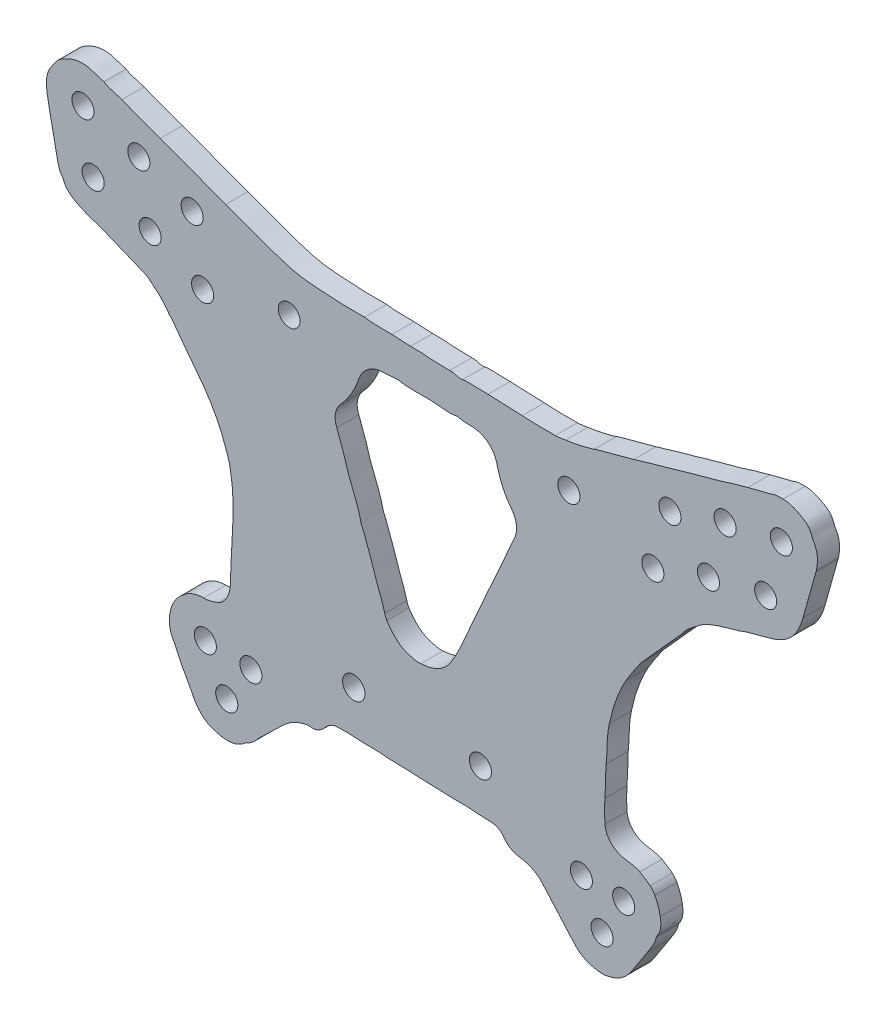
from build123d import *

# Parameters (mm, degrees)
MODEL_R             = 1.5
MODEL_R_2           = 1.523687082
MODEL_R_3           = 1.475714076
BOSS_EXTRUDE1_DEPTH = 3


with BuildPart() as part:
    # Model → Boss-Extrude1 (new body)
    with BuildSketch(Plane.XY):
        with BuildLine():
            add(Edge.make_bspline(
                [(106.400319922, 210.053194787), (105.745680217, 209.783149141), (105.084097363, 209.566078117), (104.35840404, 209.57292321)],
                knots=[138, 138, 138, 138, 139, 139, 139, 139], degree=3))
            add(Edge.make_bspline(
                [(104.35840404, 209.57292321), (103.396302713, 209.581977731), (102.505616627, 209.272823165), (101.756717483, 208.698599326), (100.458069769, 207.702849885), (99.720732207, 206.382562486), (99.728791219, 204.7593255)],
                knots=[139, 139, 139, 139, 140, 140, 140, 141, 141, 141, 141], degree=3))
            add(Edge.make_bspline(
                [(99.728791219, 204.7593255), (99.705781708, 203.731147042), (99.827379793, 203.274002176), (100.308316804, 202.456596844)],
                knots=[0, 0, 0, 0, 1, 1, 1, 1], degree=3))
            add(Edge.make_bspline(
                [(100.308316804, 202.456596844), (100.407421981, 202.288143534), (100.479539802, 202.103790611), (100.563312194, 201.926386026), (100.83953998, 201.34143511), (101.09793462, 200.747264482), (101.396097382, 200.173722055)],
                knots=[1, 1, 1, 1, 2, 2, 2, 3, 3, 3, 3], degree=3))
            add(Edge.make_bspline(
                [(101.396097382, 200.173722055), (101.720813554, 199.549063403), (102.089575323, 198.947407568), (102.425336474, 198.328262158)],
                knots=[3, 3, 3, 3, 4, 4, 4, 4], degree=3))
            add(Edge.make_bspline(
                [(102.425336474, 198.328262158), (102.666848518, 197.88289746), (102.862062574, 197.411288076), (103.119372347, 196.97584515), (103.772141948, 195.871173031), (104.633216333, 195.015061431), (105.946463256, 194.732936209)],
                knots=[4, 4, 4, 4, 5, 5, 5, 6, 6, 6, 6], degree=3))
            add(Edge.make_bspline(
                [(105.946463256, 194.732936209), (106.083363132, 194.703511599), (106.21172872, 194.636413164), (106.347523064, 194.599565293)],
                knots=[6, 6, 6, 6, 7, 7, 7, 7], degree=3))
            add(Edge.make_bspline(
                [(106.347523064, 194.599565293), (107.646987012, 194.24687263), (108.852604803, 194.390908675), (109.917065908, 195.278055495)],
                knots=[7, 7, 7, 7, 8, 8, 8, 8], degree=3))
            add(Edge.make_bspline(
                [(109.917065908, 195.278055495), (110.003183679, 195.34982057), (110.090221003, 195.433231595), (110.191826541, 195.471679751)],
                knots=[8, 8, 8, 8, 9, 9, 9, 9], degree=3))
            add(Edge.make_bspline(
                [(110.191826541, 195.471679751), (110.938070344, 195.754032111), (111.427675958, 196.33553467), (111.922850555, 196.917398583)],
                knots=[9, 9, 9, 9, 10, 10, 10, 10], degree=3))
            add(Edge.make_bspline(
                [(111.922850555, 196.917398583), (112.10405433, 197.130308864), (112.318062414, 197.316107207), (112.523319238, 197.507635605), (112.914377606, 197.872542062), (113.316181323, 198.226143275), (113.701929009, 198.596470056), (114.148801198, 199.025480865), (114.576548732, 199.474407489), (115.024423132, 199.902313585)],
                knots=[10, 10, 10, 10, 11, 11, 11, 12, 12, 12, 13, 13, 13, 13], degree=3))
            add(Edge.make_bspline(
                [(115.024423132, 199.902313585), (115.828815802, 200.670822444), (116.714852459, 201.293158101), (117.831872784, 201.545311519), (118.162870852, 201.620029379), (118.474010689, 201.740732225), (118.82142641, 201.67948774)],
                knots=[13, 13, 13, 13, 14, 14, 14, 15, 15, 15, 15], degree=3))
            add(Edge.make_bspline(
                [(118.82142641, 201.67948774), (119.526021654, 201.555295238), (120.089429216, 201.84693958), (120.585564696, 202.306407441)],
                knots=[15, 15, 15, 15, 16, 16, 16, 16], degree=3))
            add(Edge.make_bspline(
                [(120.585564696, 202.306407441), (120.750278493, 202.458940488), (120.884244061, 202.644067743), (121.041911389, 202.804829356)],
                knots=[16, 16, 16, 16, 17, 17, 17, 17], degree=3))
            add(Edge.make_bspline(
                [(121.041911389, 202.804829356), (121.431822898, 203.202422942), (121.907180593, 203.453141265), (122.462177853, 203.476360896), (123.165719227, 203.50579583), (123.875821463, 203.533186528), (124.575240342, 203.471921393), (125.701022259, 203.373312815), (126.8260706, 203.373921956), (127.952834063, 203.367871843), (128.233081023, 203.366364478), (128.513441635, 203.337404467), (128.793254648, 203.314907546)],
                knots=[17, 17, 17, 17, 18, 18, 18, 19, 19, 19, 20, 20, 20, 21, 21, 21, 21], degree=3))
            add(Edge.make_bspline(
                [(128.793254648, 203.314907546), (129.017780775, 203.296860452), (129.241170375, 203.25482972), (129.465748163, 203.248717661)],
                knots=[21, 21, 21, 21, 22, 22, 22, 22], degree=3))
            add(Edge.make_bspline(
                [(129.465748163, 203.248717661), (130.732366472, 203.214275381), (131.998571499, 203.220562955), (133.265024496, 203.119497164)],
                knots=[22, 22, 22, 22, 23, 23, 23, 23], degree=3))
            add(Edge.make_bspline(
                [(133.265024496, 203.119497164), (134.66724084, 203.007601052), (136.07843575, 203.071116911), (137.484547283, 202.960810761)],
                knots=[23, 23, 23, 23, 24, 24, 24, 24], degree=3))
            add(Edge.make_bspline(
                [(137.484547283, 202.960810761), (138.352688801, 202.892721181), (139.229891541, 202.942361014), (140.102951122, 202.932645731)],
                knots=[24, 24, 24, 24, 25, 25, 25, 25], degree=3))
            add(Edge.make_bspline(
                [(140.102951122, 202.932645731), (140.27121915, 202.930766685), (140.438774265, 202.893619406), (140.607290263, 202.881591452)],
                knots=[25, 25, 25, 25, 26, 26, 26, 26], degree=3))
            add(Edge.make_bspline(
                [(140.607290263, 202.881591452), (141.028642248, 202.85148543), (141.450128551, 202.822071145), (141.871986808, 202.800534395)],
                knots=[26, 26, 26, 26, 27, 27, 27, 27], degree=3))
            add(Edge.make_bspline(
                [(141.871986808, 202.800534395), (142.350764417, 202.776106807), (142.82986232, 202.749779525), (143.309073875, 202.743574546)],
                knots=[27, 27, 27, 27, 28, 28, 28, 28], degree=3))
            add(Edge.make_bspline(
                [(143.309073875, 202.743574546), (144.107897562, 202.733219148), (144.72139498, 202.385234422), (145.15806942, 201.733216044)],
                knots=[28, 28, 28, 28, 29, 29, 29, 29], degree=3))
            add(Edge.make_bspline(
                [(145.15806942, 201.733216044), (145.436497936, 201.317503094), (145.824074397, 201.062272997), (146.255696457, 200.835589934)],
                knots=[29, 29, 29, 29, 30, 30, 30, 30], degree=3))
            add(Edge.make_bspline(
                [(146.255696457, 200.835589934), (146.642652995, 200.632374287), (147.05740279, 200.584035332), (147.473330441, 200.5088219), (148.581723491, 200.308393848), (149.575812894, 199.885278285), (150.339393904, 199.015765582)],
                knots=[30, 30, 30, 30, 31, 31, 31, 32, 32, 32, 32], degree=3))
            add(Edge.make_bspline(
                [(150.339393904, 199.015765582), (151.548431609, 197.639013906), (152.768183667, 196.271636807), (153.973284855, 194.89147807), (154.474328066, 194.317646559), (154.959067277, 193.734233982), (155.590852452, 193.29011854), (156.389996433, 192.728356281), (158.0265647, 192.330174203), (158.974387111, 192.490058241)],
                knots=[32, 32, 32, 32, 33, 33, 33, 34, 34, 34, 35, 35, 35, 35], degree=3))
            add(Edge.make_bspline(
                [(158.974387111, 192.490058241), (160.409366437, 192.732124696), (161.557723919, 193.431139854), (162.380187373, 194.63819929)],
                knots=[35, 35, 35, 35, 36, 36, 36, 36], degree=3))
            add(Edge.make_bspline(
                [(162.380187373, 194.63819929), (162.745053953, 195.173675564), (163.091787758, 195.721551472), (163.443449958, 196.2659274), (163.810362288, 196.833915287), (164.173493081, 197.404339738), (164.537905051, 197.973948559)],
                knots=[36, 36, 36, 36, 37, 37, 37, 38, 38, 38, 38], degree=3))
            add(Edge.make_bspline(
                [(164.537905051, 197.973948559), (165.023460495, 198.732866028), (165.563155965, 199.46309192), (165.78411753, 200.361017439)],
                knots=[38, 38, 38, 38, 39, 39, 39, 39], degree=3))
            add(Edge.make_bspline(
                [(165.78411753, 200.361017439), (165.810505626, 200.468226263), (165.862961526, 200.575796441), (165.927619595, 200.6657738)],
                knots=[39, 39, 39, 39, 40, 40, 40, 40], degree=3))
            add(Edge.make_bspline(
                [(165.927619595, 200.6657738), (166.464349763, 201.412766558), (166.466033889, 202.253866445), (166.327119261, 203.101966292)],
                knots=[40, 40, 40, 40, 41, 41, 41, 41], degree=3))
            add(Edge.make_bspline(
                [(166.327119261, 203.101966292), (166.203630408, 203.855835116), (165.955278536, 204.581476965), (165.594038511, 205.255032091)],
                knots=[41, 41, 41, 41, 42, 42, 42, 42], degree=3))
            add(Edge.make_bspline(
                [(165.594038511, 205.255032091), (165.437931325, 205.546118914), (165.222001476, 205.832797208), (164.965580261, 206.03637421)],
                knots=[42, 42, 42, 42, 43, 43, 43, 43], degree=3))
            add(Edge.make_bspline(
                [(164.965580261, 206.03637421), (164.525992179, 206.385360405), (164.048299437, 206.69453562), (163.557102685, 206.967389509)],
                knots=[43, 43, 43, 43, 44, 44, 44, 44], degree=3))
            add(Edge.make_bspline(
                [(163.557102685, 206.967389509), (163.267722179, 207.128140798), (162.926753667, 207.209125583), (162.599547467, 207.285619244), (162.189095811, 207.381574445), (161.768229432, 207.432318991), (161.353107682, 207.5092979), (160.001394477, 207.759954276), (158.933720099, 208.836038064), (158.822009801, 210.197943218)],
                knots=[44, 44, 44, 44, 45, 45, 45, 46, 46, 46, 47, 47, 47, 47], degree=3))
            add(Edge.make_bspline(
                [(158.822009801, 210.197943218), (158.739353273, 211.205539936), (158.738196081, 212.228803967), (158.81049988, 213.237221477)],
                knots=[47, 47, 47, 47, 48, 48, 48, 48], degree=3))
            add(Edge.make_bspline(
                [(158.81049988, 213.237221477), (158.866943956, 214.024624032), (158.926115699, 214.806941809), (158.914977731, 215.597255852), (158.906650086, 216.187936823), (158.949342183, 216.779830915), (158.982456455, 217.37044994)],
                knots=[48, 48, 48, 48, 49, 49, 49, 50, 50, 50, 50], degree=3))
            add(Edge.make_bspline(
                [(158.982456455, 217.37044994), (159.009226838, 217.848001031), (159.093216203, 218.325041063), (159.08584944, 218.801286114), (159.067479026, 219.989286662), (159.174488235, 221.152916407), (159.417095478, 222.32307635)],
                knots=[50, 50, 50, 50, 51, 51, 51, 52, 52, 52, 52], degree=3))
            add(Edge.make_bspline(
                [(159.417095478, 222.32307635), (159.873276858, 224.523324769), (160.582542196, 226.62533629), (161.693569923, 228.573162856)],
                knots=[52, 52, 52, 52, 53, 53, 53, 53], degree=3))
            add(Edge.make_bspline(
                [(161.693569923, 228.573162856), (162.292654109, 229.623487205), (163.018357764, 230.602041316), (163.695511041, 231.60720147)],
                knots=[53, 53, 53, 53, 54, 54, 54, 54], degree=3))
            add(Edge.make_bspline(
                [(163.695511041, 231.60720147), (163.804380021, 231.76882001), (163.959030386, 231.899465277), (164.091218839, 232.045602343)],
                knots=[54, 54, 54, 54, 55, 55, 55, 55], degree=3))
            add(Edge.make_bspline(
                [(164.091218839, 232.045602343), (165.148003219, 233.213986485), (166.206327077, 234.380981992), (167.260208146, 235.551978214), (167.749782764, 236.095956651), (168.229428267, 236.648845067), (168.71583094, 237.195693695)],
                knots=[55, 55, 55, 55, 56, 56, 56, 57, 57, 57, 57], degree=3))
            add(Edge.make_bspline(
                [(168.71583094, 237.195693695), (168.903202958, 237.406363576), (169.127047169, 237.591243045), (169.282224469, 237.822716641)],
                knots=[57, 57, 57, 57, 58, 58, 58, 58], degree=3))
            add(Edge.make_bspline(
                [(169.282224469, 237.822716641), (169.811691194, 238.612571247), (170.547065663, 239.175933792), (171.301502794, 239.722601742), (171.347180858, 239.755696685), (171.394687698, 239.786829987), (171.43720415, 239.823652046), (172.289361962, 240.561667717), (173.335917596, 240.925541733), (174.374083593, 241.26874625)],
                knots=[58, 58, 58, 58, 59, 59, 59, 60, 60, 60, 61, 61, 61, 61], degree=3))
            add(Edge.make_bspline(
                [(174.374083593, 241.26874625), (175.603124179, 241.675063975), (176.880188207, 241.932281523), (178.084535154, 242.4239874)],
                knots=[61, 61, 61, 61, 62, 62, 62, 62], degree=3))
            add(Edge.make_bspline(
                [(178.084535154, 242.4239874), (178.213603323, 242.4766781), (178.357838965, 242.491338783), (178.493664306, 242.528625442), (179.552101816, 242.819170233), (180.613246328, 243.100639854), (181.666745111, 243.408142512), (182.016733517, 243.51029753), (182.356141887, 243.661519375), (182.684102327, 243.823292781), (183.295843294, 244.125049897), (183.827076802, 244.528053481), (184.28249361, 245.0494937)],
                knots=[62, 62, 62, 62, 63, 63, 63, 64, 64, 64, 65, 65, 65, 66, 66, 66, 66], degree=3))
            add(Edge.make_bspline(
                [(184.28249361, 245.0494937), (185.009395785, 245.881843638), (185.403068165, 246.868837966), (185.698048651, 247.904594552)],
                knots=[66, 66, 66, 66, 67, 67, 67, 67], degree=3))
            add(Edge.make_bspline(
                [(185.698048651, 247.904594552), (186.292225106, 249.990876812), (186.86914701, 252.082058012), (187.453239368, 254.171213043)],
                knots=[67, 67, 67, 67, 68, 68, 68, 68], degree=3))
            add(Edge.make_bspline(
                [(187.453239368, 254.171213043), (187.475990578, 254.25264436), (187.504279775, 254.332973544), (187.520769752, 254.415651535)],
                knots=[68, 68, 68, 68, 69, 69, 69, 69], degree=3))
            add(Edge.make_bspline(
                [(187.520769752, 254.415651535), (187.746918014, 255.550303201), (187.760370364, 256.654064189), (187.089777949, 257.674556113), (186.968541486, 257.859048416), (186.911074534, 258.086276093), (186.829905823, 258.295990964), (186.629298429, 258.814289977), (186.291171235, 259.226789451), (185.820442306, 259.510393647), (184.948395267, 260.035780378), (184.064549008, 260.514250342), (182.991357307, 260.51895828)],
                knots=[69, 69, 69, 69, 70, 70, 70, 71, 71, 71, 72, 72, 72, 73, 73, 73, 73], degree=3))
            add(Edge.make_bspline(
                [(182.991357307, 260.51895828), (182.47808093, 260.521206423), (181.980426637, 260.545448172), (181.499138336, 260.335082862), (181.37128935, 260.279199333), (181.23081458, 260.250435487), (181.094451973, 260.215804786), (180.138632542, 259.973054337), (179.180374744, 259.739446166), (178.226828368, 259.488108377)],
                knots=[73, 73, 73, 73, 74, 74, 74, 75, 75, 75, 76, 76, 76, 76], degree=3))
            add(Edge.make_bspline(
                [(178.226828368, 259.488108377), (177.464776504, 259.287249281), (176.689044985, 259.115977403), (175.95524099, 258.837316025), (175.347839491, 258.606658058), (174.73202769, 258.445367319), (174.106793045, 258.28466249), (172.688531002, 257.920130292), (171.282760427, 257.507065557), (169.872268097, 257.112463473), (169.763843396, 257.082130314), (169.659210563, 257.038365079), (169.55107516, 257.006823962), (169.20101443, 256.904723147), (168.850468093, 256.804274241), (168.499529137, 256.705229456), (167.495913569, 256.42197629), (166.490427897, 256.14517847), (165.488682433, 255.855503512), (164.569975784, 255.589838004), (163.65924549, 255.296061668), (162.737790511, 255.040663799)],
                knots=[76, 76, 76, 76, 77, 77, 77, 78, 78, 78, 79, 79, 79, 80, 80, 80, 81, 81, 81, 82, 82, 82, 83, 83, 83, 83], degree=3))
            add(Edge.make_bspline(
                [(162.737790511, 255.040663799), (161.056050451, 254.574547008), (159.368824065, 254.12822472), (157.684500989, 253.671405074), (157.576169276, 253.642021762), (157.474749716, 253.58790371), (157.367130916, 253.55500235)],
                knots=[83, 83, 83, 83, 84, 84, 84, 85, 85, 85, 85], degree=3))
            add(Edge.make_bspline(
                [(157.367130916, 253.55500235), (157.044532818, 253.456393772), (156.72258564, 253.354620758), (156.396577959, 253.268411814), (155.44216369, 253.016036421), (154.476518464, 252.822360542), (153.49657366, 252.692758042)],
                knots=[85, 85, 85, 85, 86, 86, 86, 87, 87, 87, 87], degree=3))
            add(Edge.make_bspline(
                [(153.49657366, 252.692758042), (153.023623336, 252.630202355), (152.563247137, 252.514228095), (152.07607989, 252.518223647)],
                knots=[87, 87, 87, 87, 88, 88, 88, 88], degree=3))
            add(Edge.make_bspline(
                [(152.07607989, 252.518223647), (150.583086014, 252.530483901), (149.092189547, 252.510495815), (147.599009693, 252.62167438)],
                knots=[88, 88, 88, 88, 89, 89, 89, 89], degree=3))
            add(Edge.make_bspline(
                [(147.599009693, 252.62167438), (146.05442781, 252.736672982), (144.502427504, 252.753346927), (142.953454494, 252.807033934)],
                knots=[89, 89, 89, 89, 90, 90, 90, 90], degree=3))
            add(Edge.make_bspline(
                [(142.953454494, 252.807033934), (142.389984939, 252.826567745), (141.825936789, 252.834130386), (141.262095281, 252.837480662), (140.671999992, 252.840985804), (140.058016967, 252.934086302), (139.498101644, 252.802563459)],
                knots=[90, 90, 90, 90, 91, 91, 91, 92, 92, 92, 92], degree=3))
            add(Edge.make_bspline(
                [(139.498101644, 252.802563459), (138.887032261, 252.659017823), (138.406952812, 253.069769888), (137.84479543, 253.003863924), (137.817115825, 253.000622055), (137.788496002, 253.006192082), (137.760299794, 253.006641194)],
                knots=[92, 92, 92, 92, 93, 93, 93, 94, 94, 94, 94], degree=3))
            add(Edge.make_bspline(
                [(137.760299794, 253.006641194), (136.549815599, 253.025756866), (135.336727724, 252.984335275), (134.133331327, 253.168259735), (134.022953865, 253.185129844), (133.90800963, 253.171579037), (133.795204133, 253.173261919), (133.344323103, 253.179988281), (132.893028789, 253.177376202), (132.44265403, 253.196285385)],
                knots=[94, 94, 94, 94, 95, 95, 95, 96, 96, 96, 97, 97, 97, 97], degree=3))
            add(Edge.make_bspline(
                [(132.44265403, 253.196285385), (131.598286596, 253.231723972), (130.754797388, 253.289354909), (129.910305969, 253.320209452)],
                knots=[97, 97, 97, 97, 98, 98, 98, 98], degree=3))
            add(Edge.make_bspline(
                [(129.910305969, 253.320209452), (128.673010063, 253.365425269), (127.430217498, 253.282731791), (126.19976142, 253.486133277)],
                knots=[98, 98, 98, 98, 99, 99, 99, 99], degree=3))
            add(Edge.make_bspline(
                [(126.19976142, 253.486133277), (126.117311532, 253.49976668), (126.030842472, 253.48922028), (125.946243515, 253.489643581), (125.016791517, 253.494268924), (124.083010383, 253.44343662), (123.158838071, 253.515583698), (121.503248471, 253.644827424), (119.842079555, 253.649266927), (118.187657478, 253.843151875), (116.401243258, 254.052505392), (114.739154788, 254.664093323), (113.057528381, 255.219508642), (111.961885101, 255.581379719), (110.897558313, 256.037071422), (109.814540817, 256.438177893), (108.996189525, 256.741259116), (108.166514289, 257.013816178), (107.34882425, 257.318577702)],
                knots=[99, 99, 99, 99, 100, 100, 100, 101, 101, 101, 102, 102, 102, 103, 103, 103, 104, 104, 104, 105, 105, 105, 105], degree=3))
            add(Edge.make_bspline(
                [(107.34882425, 257.318577702), (105.10523677, 258.154773487), (102.865275846, 259.00067165), (100.623961422, 259.842982076), (99.911472479, 260.110746024), (99.202000499, 260.386872756), (98.486246623, 260.645595089)],
                knots=[105, 105, 105, 105, 106, 106, 106, 107, 107, 107, 107], degree=3))
            add(Edge.make_bspline(
                [(98.486246623, 260.645595089), (97.561444055, 260.979876723), (96.627001669, 261.28786721), (95.705536358, 261.630857496), (94.887081746, 261.93550545), (94.083732614, 262.280416079), (93.26811932, 262.592969962)],
                knots=[107, 107, 107, 107, 108, 108, 108, 109, 109, 109, 109], degree=3))
            add(Edge.make_bspline(
                [(93.26811932, 262.592969962), (92.457723719, 262.903528649), (91.564196315, 262.983984308), (90.818975387, 263.480222607)],
                knots=[109, 109, 109, 109, 110, 110, 110, 110], degree=3))
            add(Edge.make_bspline(
                [(90.818975387, 263.480222607), (90.730057626, 263.539428019), (90.601919343, 263.537164389), (90.494920467, 263.572399068), (90.200745882, 263.669270562), (89.904411896, 263.761217305), (89.615537661, 263.872284882), (87.835085043, 264.556858751), (86.24504207, 264.115123089), (84.768372857, 263.046488373)],
                knots=[110, 110, 110, 110, 111, 111, 111, 112, 112, 112, 113, 113, 113, 113], degree=3))
            add(Edge.make_bspline(
                [(84.768372857, 263.046488373), (84.567569153, 262.901164356), (84.410123965, 262.689820806), (84.252136343, 262.493362496)],
                knots=[113, 113, 113, 113, 114, 114, 114, 114], degree=3))
            add(Edge.make_bspline(
                [(84.252136343, 262.493362496), (84.093477137, 262.296078231), (83.967477591, 262.072848688), (83.81279623, 261.872041213), (83.237403472, 261.125069104), (82.986845704, 260.268330295), (83.01908175, 259.342523668), (83.039549573, 258.75465094), (83.116993574, 258.163198217), (83.229303132, 257.585069164), (83.653692745, 255.400402883), (84.098384868, 253.219623747), (84.54579949, 251.039507955), (84.653170321, 250.516307421), (84.761434875, 249.987856918), (85.14422759, 249.569258291), (85.235924676, 249.468982318), (85.29883146, 249.331750068), (85.343290341, 249.20077442), (85.604448808, 248.431434445), (86.165676304, 247.957667256), (86.845831046, 247.558292707), (87.976551691, 246.894354781), (89.220439455, 246.527094355), (90.442185602, 246.097004643), (90.680339724, 246.013170317), (90.918390526, 245.928086735), (91.152215513, 245.83310203)],
                knots=[114, 114, 114, 114, 115, 115, 115, 116, 116, 116, 117, 117, 117, 118, 118, 118, 119, 119, 119, 120, 120, 120, 121, 121, 121, 122, 122, 122, 123, 123, 123, 123], degree=3))
            add(Edge.make_bspline(
                [(91.152215513, 245.83310203), (92.169087122, 245.420068267), (93.184677555, 245.003906204), (94.200123338, 244.587418922)],
                knots=[123, 123, 123, 123, 124, 124, 124, 124], degree=3))
            add(Edge.make_bspline(
                [(94.200123338, 244.587418922), (94.982136754, 244.266690676), (95.766164922, 243.950592935), (96.542516365, 243.616680399)],
                knots=[124, 124, 124, 124, 125, 125, 125, 125], degree=3))
            add(Edge.make_bspline(
                [(96.542516365, 243.616680399), (96.719752626, 243.540455174), (96.876521064, 243.408772302), (97.029972909, 243.286644685)],
                knots=[125, 125, 125, 125, 126, 126, 126, 126], degree=3))
            add(Edge.make_bspline(
                [(97.029972909, 243.286644685), (97.934576289, 242.566748379), (98.824983409, 241.834638279), (99.476781796, 240.856450684)],
                knots=[126, 126, 126, 126, 127, 127, 127, 127], degree=3))
            add(Edge.make_bspline(
                [(99.476781796, 240.856450684), (99.678763355, 240.55332042), (99.946498183, 240.294461288), (100.17697558, 240.009558795)],
                knots=[127, 127, 127, 127, 128, 128, 128, 128], degree=3))
            add(Edge.make_bspline(
                [(100.17697558, 240.009558795), (100.318555881, 239.834554639), (100.44597092, 239.648141993), (100.580814714, 239.467650405), (101.086414366, 238.790884382), (101.588315139, 238.111315278), (102.099297798, 237.438627402)],
                knots=[128, 128, 128, 128, 129, 129, 129, 130, 130, 130, 130], degree=3))
            add(Edge.make_bspline(
                [(102.099297798, 237.438627402), (102.832244231, 236.473717018), (103.590793525, 235.527648707), (104.304604972, 234.54891908)],
                knots=[130, 130, 130, 130, 131, 131, 131, 131], degree=3))
            add(Edge.make_bspline(
                [(104.304604972, 234.54891908), (105.575025482, 232.807033809), (106.575407113, 230.922805697), (107.279682064, 228.877743702)],
                knots=[131, 131, 131, 131, 132, 132, 132, 132], degree=3))
            add(Edge.make_bspline(
                [(107.279682064, 228.877743702), (107.518301129, 228.184830279), (107.791883906, 227.507486089), (107.931356466, 226.784074316)],
                knots=[132, 132, 132, 132, 133, 133, 133, 133], degree=3))
            add(Edge.make_bspline(
                [(107.931356466, 226.784074316), (108.32309675, 224.752103691), (108.433587865, 222.702566057), (108.331486388, 220.638992369)],
                knots=[133, 133, 133, 133, 134, 134, 134, 134], degree=3))
            add(Edge.make_bspline(
                [(108.331486388, 220.638992369), (108.249367127, 218.979124325), (108.159870771, 217.319596987), (108.083961081, 215.659450184)],
                knots=[134, 134, 134, 134, 135, 135, 135, 135], degree=3))
            add(Edge.make_bspline(
                [(108.083961081, 215.659450184), (108.045339819, 214.814958724), (108.031660163, 213.969352226), (108.002699382, 213.124391004), (107.972002814, 212.228860752), (107.73524352, 211.405224629), (107.176960663, 210.683304736), (106.963737816, 210.407585819), (106.722308428, 210.186008183), (106.400319922, 210.053194787)],
                knots=[135, 135, 135, 135, 136, 136, 136, 137, 137, 137, 138, 138, 138, 138], degree=3))
        make_face()
        with Locations((107.49528243, 199.281103947)):
            Circle(MODEL_R, mode=Mode.SUBTRACT)
        with Locations((104.586403151, 204.670289189)):
            Circle(MODEL_R, mode=Mode.SUBTRACT)
        with Locations((110.763499316, 204.338280743)):
            Circle(MODEL_R, mode=Mode.SUBTRACT)
        with Locations((124.733186911, 209.23786239)):
            Circle(MODEL_R_2, mode=Mode.SUBTRACT)
        with Locations((158.432254108, 197.273109845)):
            Circle(MODEL_R, mode=Mode.SUBTRACT)
        with Locations((141.921432518, 208.602084925)):
            Circle(MODEL_R, mode=Mode.SUBTRACT)
        with Locations((155.623527424, 202.603704072)):
            Circle(MODEL_R, mode=Mode.SUBTRACT)
        with Locations((161.364628869, 202.41597509)):
            Circle(MODEL_R, mode=Mode.SUBTRACT)
        with Locations((104.216214449, 245.762631865)):
            Circle(MODEL_R, mode=Mode.SUBTRACT)
        with BuildLine():
            add(Edge.make_bspline(
                [(133.832998831, 216.590630675), (133.316612501, 216.524229139), (132.834146345, 216.658467305), (132.339064736, 216.791688516), (130.903816776, 217.1778891), (129.9858747, 218.176611975), (129.214069366, 219.353735742)],
                knots=[0, 0, 0, 0, 1, 1, 1, 2, 2, 2, 2], degree=3))
            add(Edge.make_bspline(
                [(128.936271106, 220.058171222), (129.004731376, 219.815779547), (129.078347346, 219.560745614), (129.214069366, 219.353735742)],
                knots=[32, 32, 32, 32, 33, 33, 33, 33], degree=3))
            add(Edge.make_bspline(
                [(122.424114522, 238.622549803), (122.465546107, 238.517854977), (122.494672201, 238.408359294), (122.533903056, 238.302719783), (123.043842176, 236.929633277), (123.575571623, 235.564109412), (123.95582265, 234.146550448), (123.999454965, 233.983889141), (124.065869486, 233.827009512), (124.126425725, 233.669252306), (124.711396308, 232.145346608), (125.39047135, 230.65408674), (125.729166807, 229.044761916), (125.746380029, 228.962976988), (125.780434519, 228.883473758), (125.815253581, 228.80682523), (126.480731624, 227.341846185), (126.973891469, 225.813733284), (127.476670467, 224.28904293), (127.635381333, 223.807754397), (127.771733609, 223.316492471), (127.968177181, 222.850793819), (128.352385389, 221.939983418), (128.667947351, 221.008260896), (128.936271106, 220.058171222)],
                knots=[24, 24, 24, 24, 25, 25, 25, 26, 26, 26, 27, 27, 27, 28, 28, 28, 29, 29, 29, 30, 30, 30, 31, 31, 31, 32, 32, 32, 32], degree=3))
            add(Edge.make_bspline(
                [(127.160736551, 247.892587246), (126.322279059, 247.447315468), (125.76033865, 246.781307496), (125.438753094, 245.891455677), (125.24759954, 245.362509601), (125.044522782, 244.834332695), (124.797855037, 244.329700639), (124.338284739, 243.389512088), (123.761672797, 242.526699937), (123.049555808, 241.749296586), (122.220283523, 240.843994266), (121.958365648, 239.79976649), (122.424114522, 238.622549803)],
                knots=[20, 20, 20, 20, 21, 21, 21, 22, 22, 22, 23, 23, 23, 24, 24, 24, 24], degree=3))
            add(Edge.make_bspline(
                [(139.218619257, 248.042115886), (138.632718787, 248.217156178), (138.102146531, 247.970614084), (137.547490229, 248.017373402), (137.378943236, 248.031584973), (137.210013956, 248.041258958), (137.04135331, 248.054185138), (136.227248497, 248.116580797), (135.413154017, 248.230577929), (134.599111196, 248.23011333), (133.361092046, 248.229406107), (132.121812383, 248.115109566), (130.896439681, 248.389362415), (130.842041354, 248.401540074), (130.78386149, 248.404916161), (130.728088997, 248.401622669), (129.940713239, 248.355131786), (129.152789882, 248.315465347), (128.366436999, 248.255387521), (127.941830413, 248.22294818), (127.542558052, 248.09535378), (127.160736551, 247.892587246)],
                knots=[13, 13, 13, 13, 14, 14, 14, 15, 15, 15, 16, 16, 16, 17, 17, 17, 18, 18, 18, 19, 19, 19, 20, 20, 20, 20], degree=3))
            add(Edge.make_bspline(
                [(146.03382567, 241.077672127), (145.195068548, 242.133169012), (144.670189261, 243.340083906), (144.32687537, 244.633775588), (144.254643896, 244.905958389), (144.183176995, 245.178610953), (144.100365486, 245.447675778), (143.578451501, 247.14345217), (142.097856104, 247.872459781), (140.81391092, 247.928000022), (140.279412479, 247.951121571), (139.717286093, 247.893129278), (139.218619257, 248.042115886)],
                knots=[9, 9, 9, 9, 10, 10, 10, 11, 11, 11, 12, 12, 12, 13, 13, 13, 13], degree=3))
            add(Edge.make_bspline(
                [(144.23811259, 232.500661675), (144.652252794, 233.42611211), (145.052062422, 234.357963688), (145.462369429, 235.285143464), (145.827143021, 236.109424863), (146.195687817, 236.932059517), (146.566536664, 237.753635917), (146.756016423, 238.173411529), (146.826419121, 238.612808709), (146.820044237, 239.070227172), (146.809329884, 239.838937357), (146.502384866, 240.488054571), (146.03382567, 241.077672127)],
                knots=[5, 5, 5, 5, 6, 6, 6, 7, 7, 7, 8, 8, 8, 9, 9, 9, 9], degree=3))
            add(Edge.make_bspline(
                [(142.910214797, 229.577228621), (143.343851609, 230.555684651), (143.800952544, 231.52373366), (144.23811259, 232.500661675)],
                knots=[4, 4, 4, 4, 5, 5, 5, 5], degree=3))
            add(Edge.make_bspline(
                [(139.251103273, 221.309765063), (140.489287736, 224.057264763), (141.689150567, 226.821985603), (142.910214797, 229.577228621)],
                knots=[3, 3, 3, 3, 4, 4, 4, 4], degree=3))
            add(Edge.make_bspline(
                [(137.950347817, 218.847049125), (138.434952711, 219.637146355), (138.870232322, 220.464638651), (139.251103273, 221.309765063)],
                knots=[2, 2, 2, 2, 3, 3, 3, 3], degree=3))
            add(Edge.make_bspline(
                [(137.950347817, 218.847049125), (137.093633564, 217.450247417), (135.777875948, 216.773863398), (134.169844848, 216.621908518), (134.057545622, 216.61129501), (133.945194736, 216.601151263), (133.832998831, 216.590630675)],
                knots=[33, 33, 33, 33, 34, 34, 34, 35, 35, 35, 35], degree=3))
        make_face(mode=Mode.SUBTRACT)
        with Locations((89.363051401, 251.529533611)):
            Circle(MODEL_R, mode=Mode.SUBTRACT)
        with Locations((97.088187572, 249.009069513)):
            Circle(MODEL_R, mode=Mode.SUBTRACT)
        with Locations((102.795888204, 254.229613107)):
            Circle(MODEL_R, mode=Mode.SUBTRACT)
        with Locations((87.974392094, 259.236088409)):
            Circle(MODEL_R, mode=Mode.SUBTRACT)
        with Locations((95.55647064, 257.006821157)):
            Circle(MODEL_R, mode=Mode.SUBTRACT)
        with Locations((115.963890784, 248.644300443)):
            Circle(MODEL_R_3, mode=Mode.SUBTRACT)
        with Locations((165.324987616, 243.565980562)):
            Circle(MODEL_R, mode=Mode.SUBTRACT)
        with Locations((172.8733061, 246.27866481)):
            Circle(MODEL_R, mode=Mode.SUBTRACT)
        with Locations((153.928197688, 246.997667117)):
            Circle(MODEL_R, mode=Mode.SUBTRACT)
        with Locations((167.638789108, 251.393679069)):
            Circle(MODEL_R, mode=Mode.SUBTRACT)
        with Locations((180.635532225, 248.012153483)):
            Circle(MODEL_R, mode=Mode.SUBTRACT)
        with Locations((175.128359087, 253.791361025)):
            Circle(MODEL_R, mode=Mode.SUBTRACT)
        with Locations((182.763287169, 255.365087925)):
            Circle(MODEL_R, mode=Mode.SUBTRACT)
    extrude(amount=BOSS_EXTRUDE1_DEPTH)


solid = part.part
